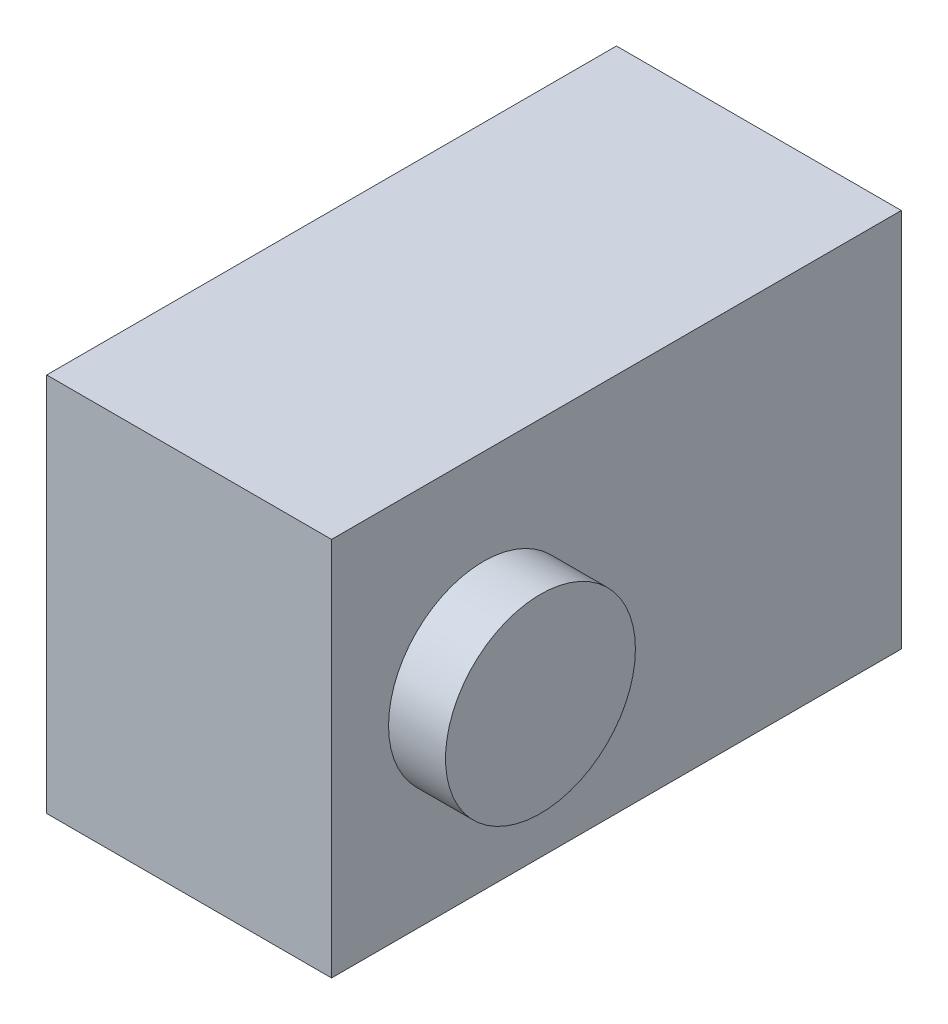
from build123d import *

# Parameters (mm, degrees)
SKIZZE1_W                             = 15
SKIZZE1_H                             = 20
AUFSATZ_LINEAR_AUSTRAGEN8_DEPTH       = 30
AUFSATZ_LINEAR_AUSTRAGEN10_DEPTH      = 3
AUFSATZ_LINEAR_AUSTRAGEN10_DEPTH_BACK = 18
SKIZZE2_R                             = 5


with BuildPart() as part:
    # Skizze1 → Aufsatz-Linear austragen8 (new body)
    with BuildSketch(Plane.XY):
        with Locations((7.5, 10)):
            Rectangle(SKIZZE1_W, SKIZZE1_H)
    extrude(amount=AUFSATZ_LINEAR_AUSTRAGEN8_DEPTH)

    # Skizze2 → Aufsatz-Linear austragen10 (add, two sides: drawn at the far end of the back side and taken through both)
    with BuildSketch(Plane(origin=(15, 0, 0), x_dir=(0, 0, -1), z_dir=(1, 0, 0)).offset(-AUFSATZ_LINEAR_AUSTRAGEN10_DEPTH_BACK)):
        with Locations((-22, 10)):
            Circle(SKIZZE2_R)
    extrude(amount=AUFSATZ_LINEAR_AUSTRAGEN10_DEPTH + AUFSATZ_LINEAR_AUSTRAGEN10_DEPTH_BACK)


with BuildPart() as part_1:
    # Körper-Verschieben/Kopieren1: moved
    add(part.part.moved(Location((3, 0, 0))))


solid = part_1.part
